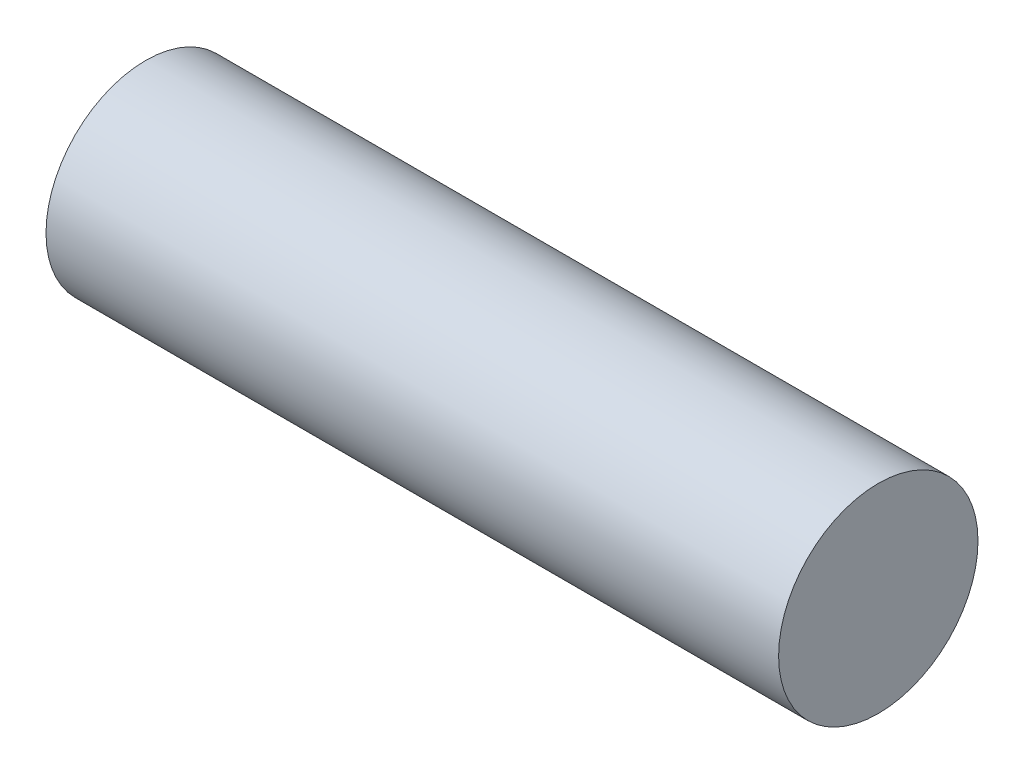
from build123d import *

# Parameters (mm, degrees)
ESBO_O1_R                = 9.05
RESSALTO_EXTRUS_O1_DEPTH = 66.5


with BuildPart() as part:
    # Esboço1 → Ressalto-extrusão1 (new body)
    with BuildSketch(Plane(origin=(0, 0, 0), x_dir=(0, 0, -1), z_dir=(1, 0, 0))):
        Circle(ESBO_O1_R)
    extrude(amount=RESSALTO_EXTRUS_O1_DEPTH)


solid = part.part
